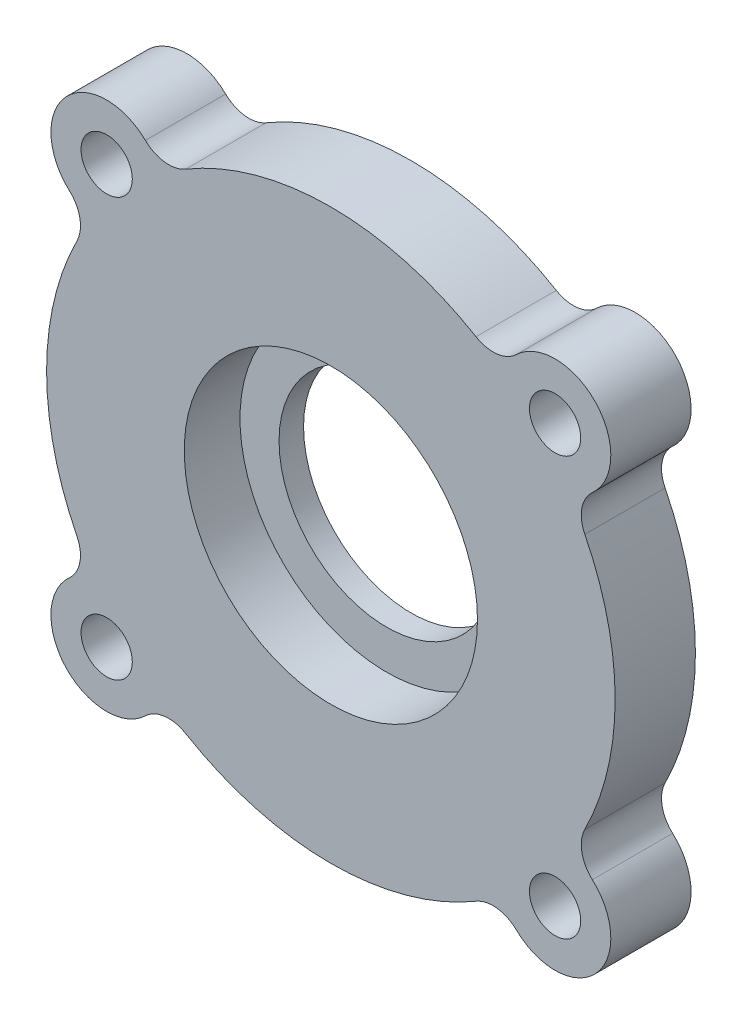
from build123d import *

# Parameters (mm, degrees)
SKETCH_1_R          = 9.65
SKETCH_1_R_2        = 2.3
EXTRUDE_1_DEPTH     = 7.2
SKETCH_3_R          = 13.15
CUT_EXTRUDE_2_DEPTH = 5


with BuildPart() as part:
    # Эскиз1 → Бобышка-Вытянуть1 (new body)
    with BuildSketch(Plane.XY):
        with BuildLine():
            ThreePointArc((16.636311976, -22.349119084), (23.768995303, -22.164946702), (23.455168213, -15.036791017))
            ThreePointArc((23.455168213, -15.036791017), (22.512808868, -13.361377812), (22.780834847, -11.457903983))
            ThreePointArc((22.780834847, -11.457903983), (25.5, 0), (22.780834847, 11.457903983))
            ThreePointArc((22.780834847, 11.457903983), (22.512808868, 13.361377812), (23.455168213, 15.036791017))
            ThreePointArc((23.455168213, 15.036791017), (23.768995303, 22.164946702), (16.636311976, 22.349119084))
            ThreePointArc((16.636311976, 22.349119084), (14.899244328, 21.525926197), (13.019103812, 21.9260789))
            ThreePointArc((13.019103812, 21.9260789), (0, 25.5), (-13.019103812, 21.9260789))
            ThreePointArc((-13.019103812, 21.9260789), (-14.899244328, 21.525926197), (-16.636311976, 22.349119084))
            ThreePointArc((-16.636311976, 22.349119084), (-23.768995303, 22.164946702), (-23.455168213, 15.036791017))
            ThreePointArc((-23.455168213, 15.036791017), (-22.512808868, 13.361377812), (-22.780834847, 11.457903983))
            ThreePointArc((-22.780834847, 11.457903983), (-25.5, 0), (-22.780834847, -11.457903983))
            ThreePointArc((-22.780834847, -11.457903983), (-22.512808868, -13.361377812), (-23.455168213, -15.036791017))
            ThreePointArc((-23.455168213, -15.036791017), (-23.768995303, -22.164946702), (-16.636311976, -22.349119084))
            ThreePointArc((-16.636311976, -22.349119084), (-14.899244328, -21.525926197), (-13.019103812, -21.9260789))
            ThreePointArc((-13.019103812, -21.9260789), (0, -25.5), (13.019103812, -21.9260789))
            ThreePointArc((13.019103812, -21.9260789), (14.899244328, -21.525926197), (16.636311976, -22.349119084))
        make_face()
        Circle(SKETCH_1_R, mode=Mode.SUBTRACT)
        with Locations((-20.112226795, -18.754954902)):
            Circle(SKETCH_1_R_2, mode=Mode.SUBTRACT)
        with Locations((20.112226795, -18.754954902)):
            Circle(SKETCH_1_R_2, mode=Mode.SUBTRACT)
        with Locations((20.112226795, 18.754954902)):
            Circle(SKETCH_1_R_2, mode=Mode.SUBTRACT)
        with Locations((-20.112226795, 18.754954902)):
            Circle(SKETCH_1_R_2, mode=Mode.SUBTRACT)
    extrude(amount=EXTRUDE_1_DEPTH)

    # Эскиз3 → Вырез-Вытянуть2 (cut)
    with BuildSketch(Plane.XY.offset(7.2)):
        Circle(SKETCH_3_R)
    extrude(amount=-CUT_EXTRUDE_2_DEPTH, mode=Mode.SUBTRACT)


solid = part.part
